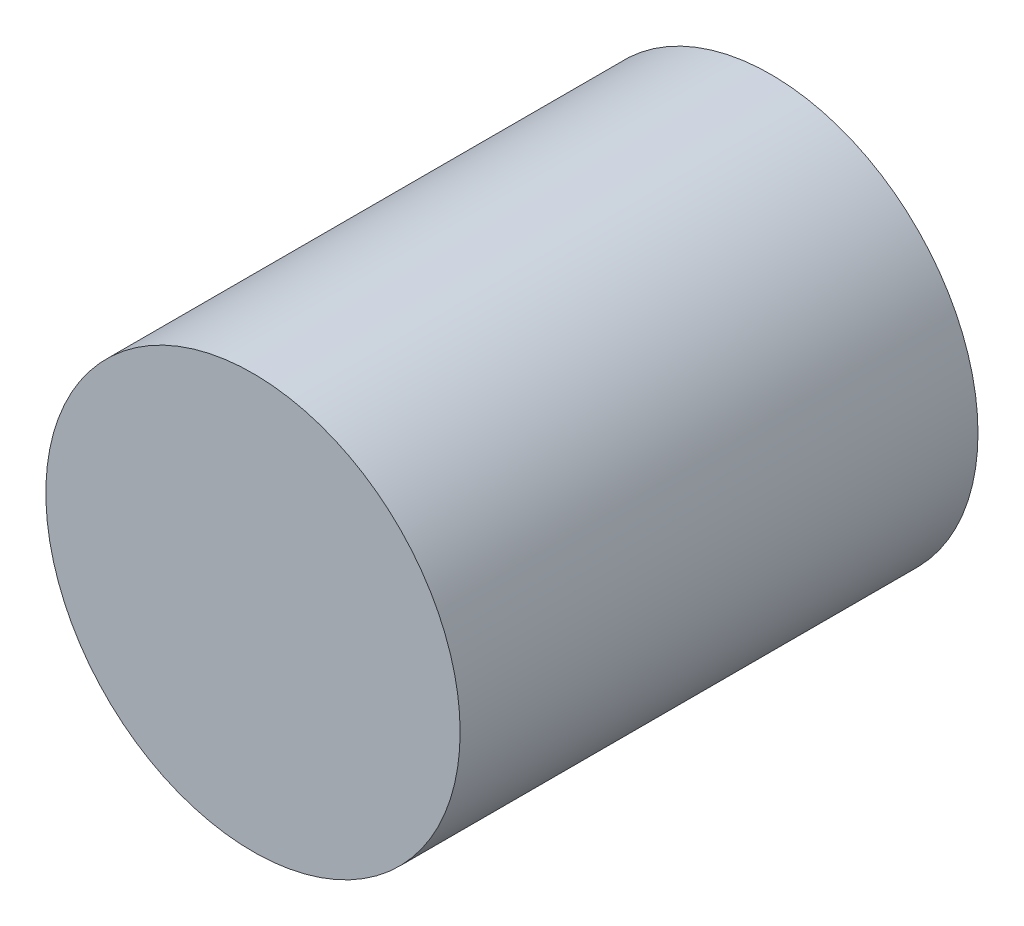
from build123d import *

# Parameters (mm, degrees)
CROQUIS1_R              = 10
SALIENTE_EXTRUIR1_DEPTH = 25


with BuildPart() as part:
    # Croquis1 → Saliente-Extruir1 (new body)
    with BuildSketch(Plane.XY):
        Circle(CROQUIS1_R)
    extrude(amount=SALIENTE_EXTRUIR1_DEPTH)


solid = part.part
